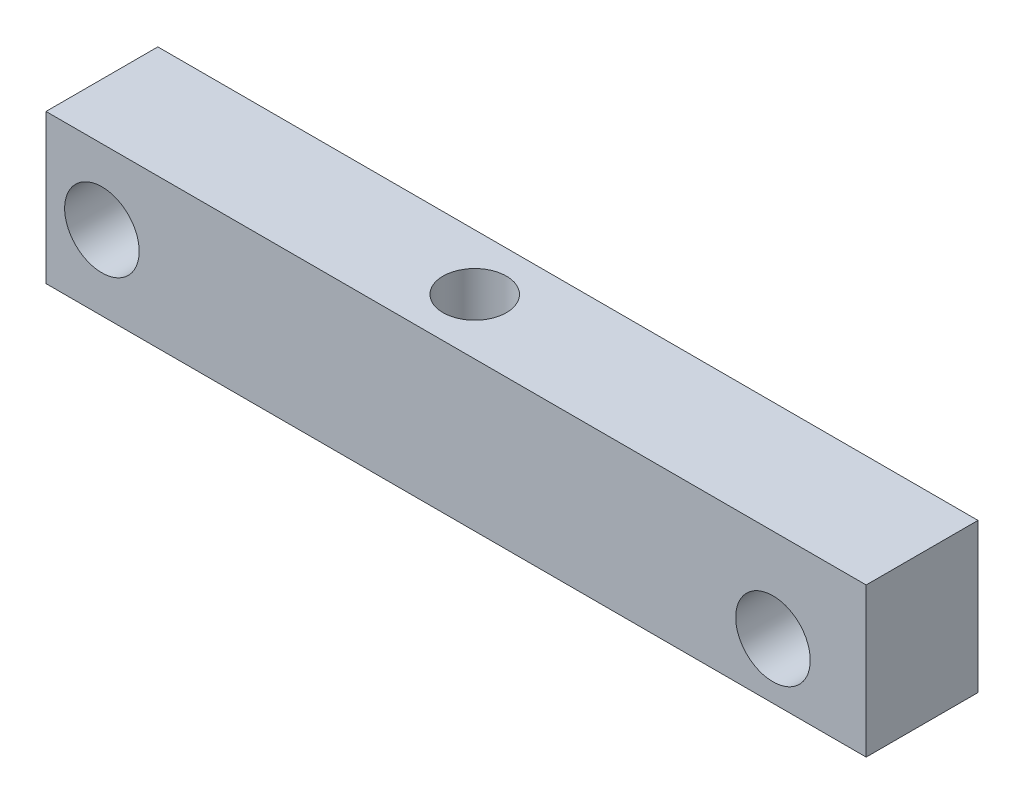
from build123d import *

# Parameters (mm, degrees)
CROQUIS1_W              = 22
CROQUIS1_H              = 4
SALIENTE_EXTRUIR1_DEPTH = 3
CROQUIS2_R              = 0.85
CORTAR_EXTRUIR1_DEPTH   = 3
CORTAR_EXTRUIR2_REACH   = 13.576
CROQUIS3_R              = 1


with BuildPart() as part:
    # Croquis1 → Saliente-Extruir1 (new body)
    with BuildSketch(Plane.XY):
        Rectangle(CROQUIS1_W, CROQUIS1_H)
    extrude(amount=SALIENTE_EXTRUIR1_DEPTH)

    # Croquis2 → Cortar-Extruir1 (cut)
    with BuildSketch(Plane(origin=(0, 2, 0), x_dir=(1, 0, 0), z_dir=(0, 1, 0))):
        with Locations(Location((-1, -1.5, 0), (0, 0, 270))):
            Circle(CROQUIS2_R)
    extrude(amount=-CORTAR_EXTRUIR1_DEPTH, mode=Mode.SUBTRACT)

    # Croquis3 → Cortar-Extruir2 (cut, up to next)
    with BuildSketch(Plane.XY.offset(3), mode=Mode.PRIVATE) as cortar_extruir2_sk1:
        with Locations((8.5, -0.5)):
            Circle(CROQUIS3_R)
    cortar_extruir2_tool1 = extrude(cortar_extruir2_sk1.sketch, amount=-CORTAR_EXTRUIR2_REACH, mode=Mode.PRIVATE) & part.part
    # Croquis3 → Cortar-Extruir2 (cut, up to next)
    with BuildSketch(Plane.XY.offset(3), mode=Mode.PRIVATE) as cortar_extruir2_sk2:
        with Locations((-9.5, 0)):
            Circle(CROQUIS3_R)
    cortar_extruir2_tool2 = extrude(cortar_extruir2_sk2.sketch, amount=-CORTAR_EXTRUIR2_REACH, mode=Mode.PRIVATE) & part.part
    add(cortar_extruir2_tool1.solids().sort_by_distance((8.5, -0.5, 3))[0], mode=Mode.SUBTRACT)
    add(cortar_extruir2_tool2.solids().sort_by_distance((-9.5, 0, 3))[0], mode=Mode.SUBTRACT)


solid = part.part
